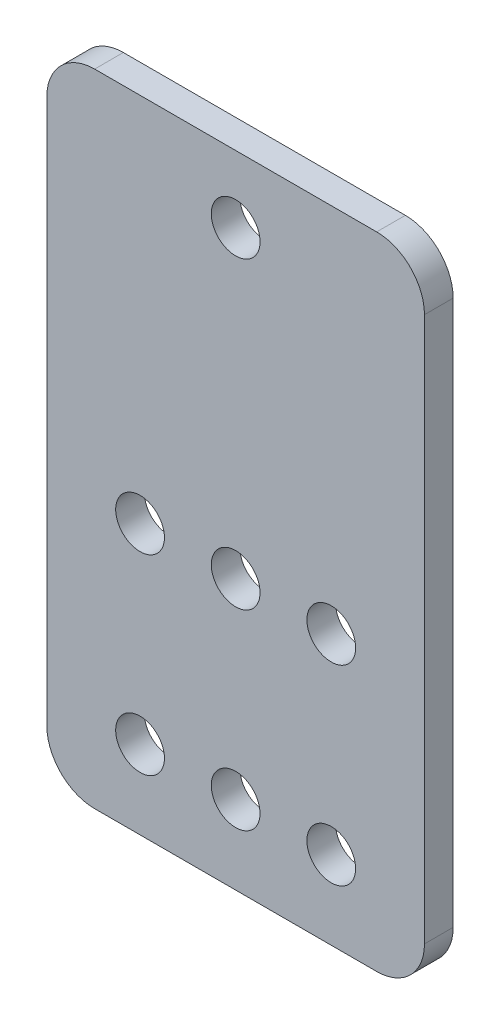
from build123d import *

# Parameters (mm, degrees)
SKETCH1_R           = 2.55
BOSS_EXTRUDE1_DEPTH = 3


with BuildPart() as part:
    # Sketch1 → Boss-Extrude1 (new body)
    with BuildSketch(Plane.XY):
        with BuildLine():
            Line((-14.75, -33.5), (14.75, -33.5))
            ThreePointArc((14.75, -33.5), (18.285533906, -32.035533906), (19.75, -28.5))
            Line((19.75, -28.5), (19.75, 28.5))
            ThreePointArc((19.75, 28.5), (18.285533906, 32.035533906), (14.75, 33.5))
            Line((14.75, 33.5), (-14.75, 33.5))
            ThreePointArc((-14.75, 33.5), (-18.285533906, 32.035533906), (-19.75, 28.5))
            Line((-19.75, 28.5), (-19.75, -28.5))
            ThreePointArc((-19.75, -28.5), (-18.285533906, -32.035533906), (-14.75, -33.5))
        make_face()
        with Locations((-10, -5.29)):
            Circle(SKETCH1_R, mode=Mode.SUBTRACT)
        with Locations((0, -5.29)):
            Circle(SKETCH1_R, mode=Mode.SUBTRACT)
        with Locations((10, -5.29)):
            Circle(SKETCH1_R, mode=Mode.SUBTRACT)
        with Locations((-10, -25.29)):
            Circle(SKETCH1_R, mode=Mode.SUBTRACT)
        with Locations((0, -25.29)):
            Circle(SKETCH1_R, mode=Mode.SUBTRACT)
        with Locations((0, 26.5)):
            Circle(SKETCH1_R, mode=Mode.SUBTRACT)
        with Locations((10, -25.29)):
            Circle(SKETCH1_R, mode=Mode.SUBTRACT)
    extrude(amount=BOSS_EXTRUDE1_DEPTH)


solid = part.part
